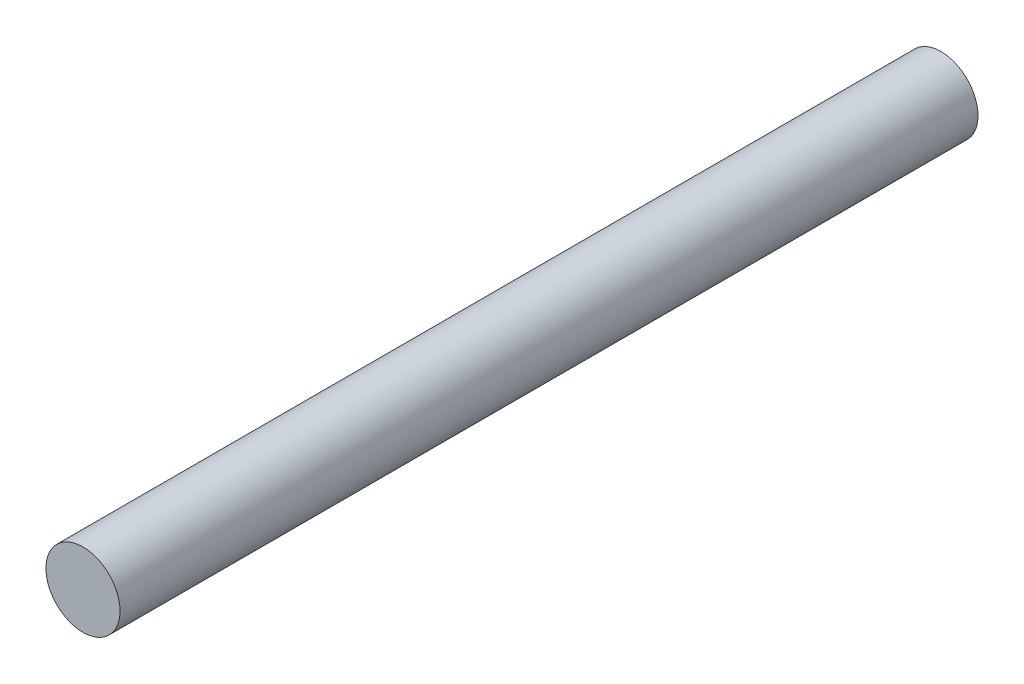
from build123d import *

# Parameters (mm, degrees)
SKETCH1_R           = 6
BOSS_EXTRUDE1_DEPTH = 139


with BuildPart() as part:
    # Sketch1 → Boss-Extrude1 (new body)
    with BuildSketch(Plane.XY):
        Circle(SKETCH1_R)
    extrude(amount=BOSS_EXTRUDE1_DEPTH)


solid = part.part
